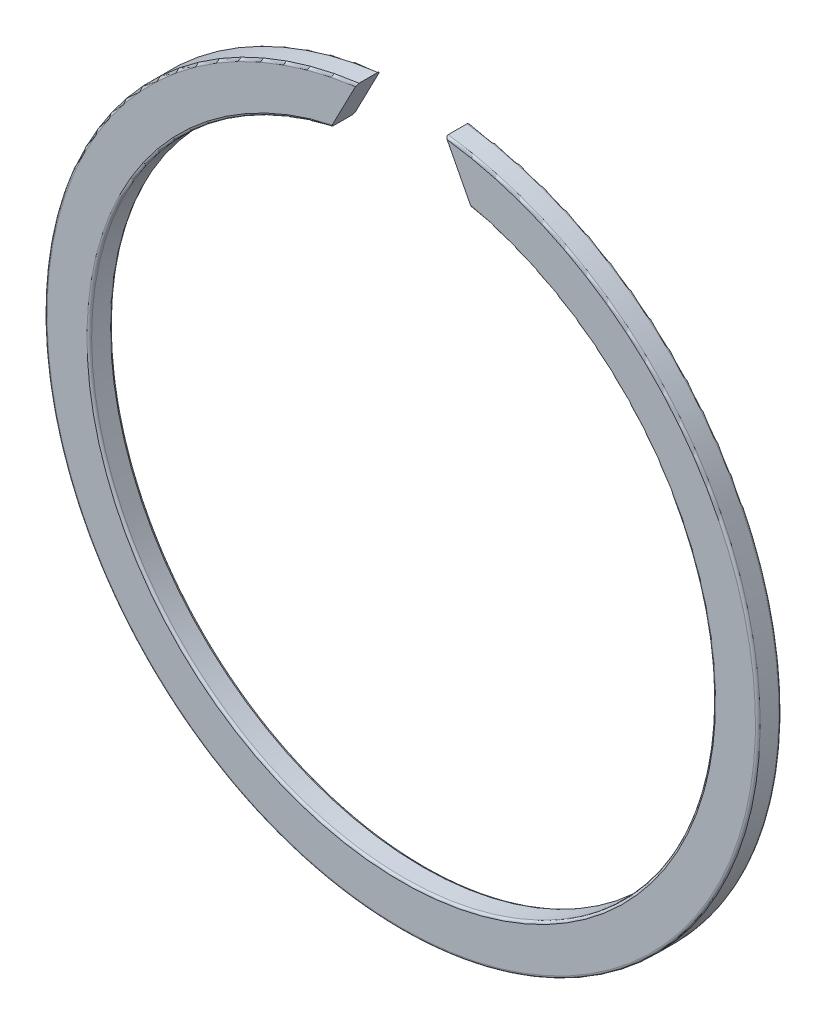
from build123d import *

# Parameters (mm, degrees)
RESSALTO_EXTRUS_O1_DEPTH = 2.5
FILETE1_R                = 0.25


with BuildPart() as part:
    # Esboço1 → Ressalto-extrusão1 (new body)
    with BuildSketch(Plane.XY):
        with BuildLine():
            Line((-4.75, 37.701956183), (-7.5, 32.3930934))
            ThreePointArc((-7.5, 32.3930934), (0, -33.25), (7.5, 32.3930934))
            Line((7.5, 32.3930934), (4.75, 37.701956183))
            ThreePointArc((4.75, 37.701956183), (0, -38), (-4.75, 37.701956183))
        make_face()
    extrude(amount=RESSALTO_EXTRUS_O1_DEPTH)

    # Filete1
    filete1_edges = [part.edges().sort_by_distance(p)[0] for p in [
        (0, -38, 2.5),
        (0, -33.25, 2.5),
        (0, -38, 0),
        (0, -33.25, 0),
    ]]
    fillet(filete1_edges, radius=FILETE1_R)


solid = part.part
